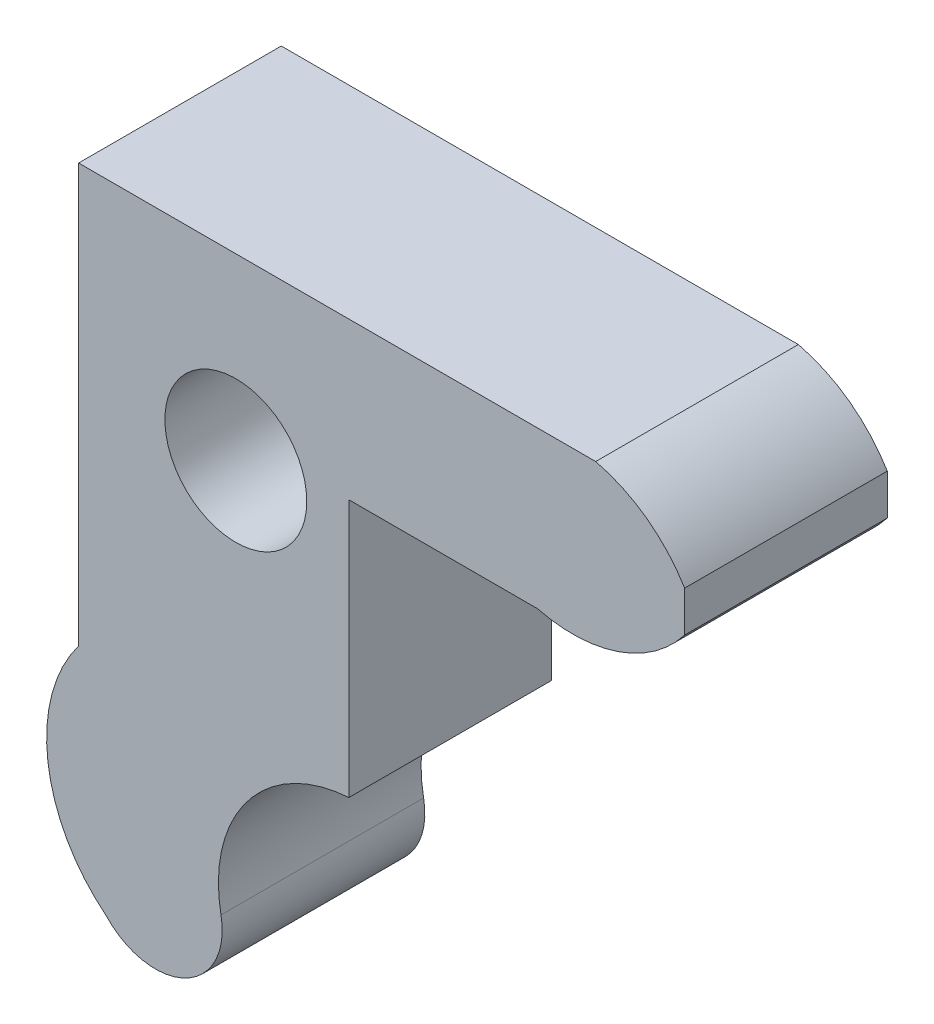
from build123d import *

# Parameters (mm, degrees)
SKETCH_1_R      = 2.1
EXTRUDE_1_DEPTH = 3


with BuildPart() as part:
    # 스케치1 → 보스-돌출1 (new, symmetric)
    with BuildSketch(Plane.XY):
        with BuildLine():
            Line((-4.654662174, -7.079831659), (-4.654662174, 5.301751688))
            Line((-4.654662174, 5.301751688), (10.655145319, 5.301751688))
            ThreePointArc((10.655145319, 5.301751688), (12.164725545, 4.600439307), (13.28874021, 3.372733093))
            Line((13.28874021, 3.372733093), (13.28874021, 2.168909846))
            ThreePointArc((13.28874021, 2.168909846), (11.333538367, 0.764001831), (8.927874518, 0.66724324))
            Line((8.927874518, 0.66724324), (3.345337826, 0.66724324))
            Line((3.345337826, 0.66724324), (3.345337826, -6.968753808))
            ThreePointArc((3.345337826, -6.968753808), (0.343177667, -8.564508011), (-0.439769501, -11.873041045))
            ThreePointArc((-0.439769501, -11.873041045), (-1.484211123, -14.014409685), (-3.830025316, -13.597907913))
            ThreePointArc((-3.830025316, -13.597907913), (-5.564151963, -10.506098848), (-4.654662174, -7.079831659))
        make_face()
        Circle(SKETCH_1_R, mode=Mode.SUBTRACT)
    extrude(amount=EXTRUDE_1_DEPTH, both=True)


solid = part.part
